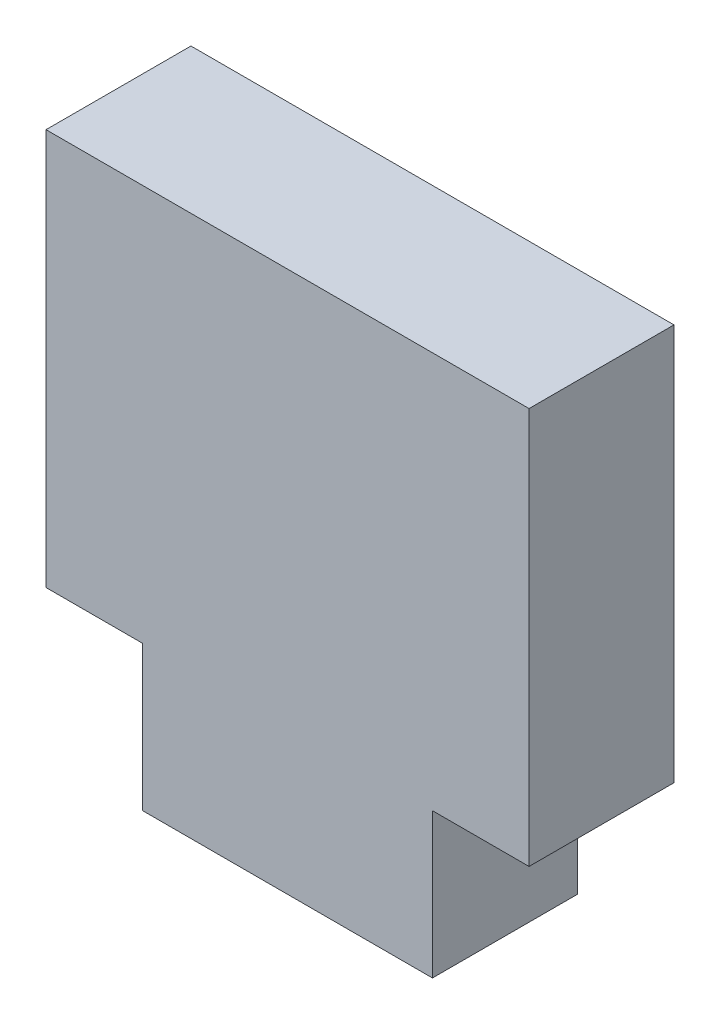
from build123d import *

# Parameters (mm, degrees)
SKETCH1_W           = 10
SKETCH1_H           = 8.21
SKETCH1_W_2         = 6
SKETCH1_H_2         = 3
BOSS_EXTRUDE1_DEPTH = 3


with BuildPart() as part:
    # Sketch1 → Boss-Extrude1 (new body)
    with BuildSketch(Plane.XY):
        Rectangle(SKETCH1_W, SKETCH1_H)
        with Locations((0, -5.605)):
            Rectangle(SKETCH1_W_2, SKETCH1_H_2)
    extrude(amount=BOSS_EXTRUDE1_DEPTH)


solid = part.part
